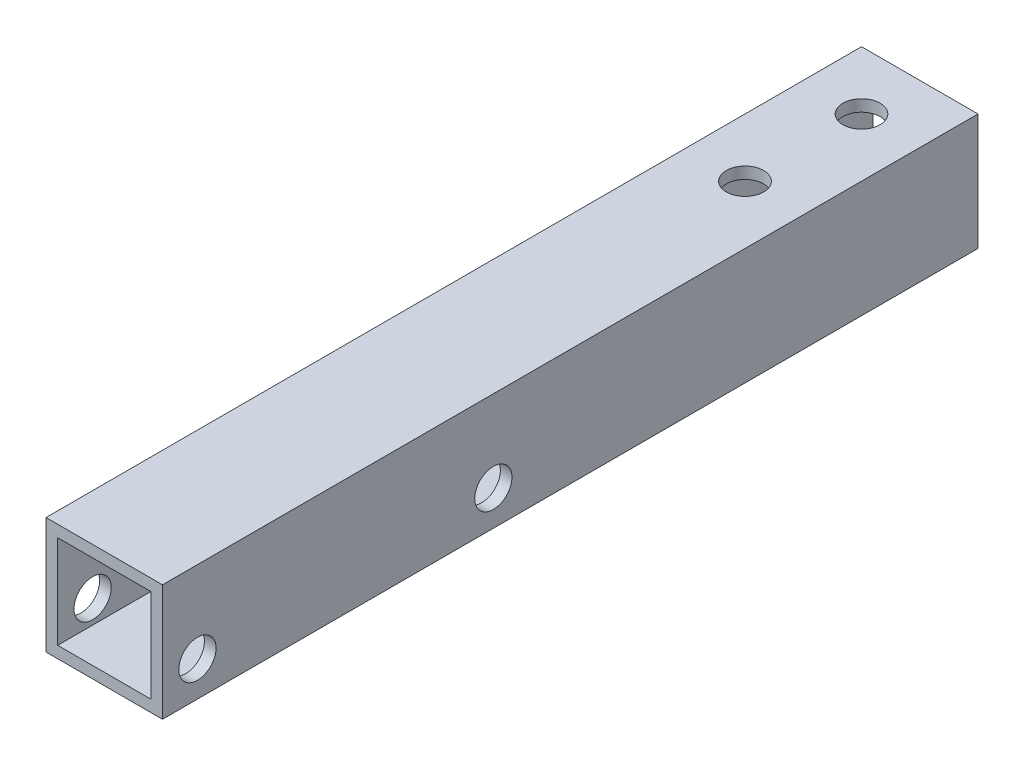
from build123d import *

# Parameters (mm, degrees)
SKETCH_1_W               = 10
SKETCH_1_H               = 10
SKETCH_1_W_2             = 8
SKETCH_1_H_2             = 8
EXTRUDE_1_DEPTH          = 70
CUT_EXTRUDE_2_DEPTH      = 71.887234394
CUT_EXTRUDE_2_DEPTH_BACK = 71.887234394
SKETCH_3_R               = 1.6
SKETCH_4_R               = 1.6
CUT_EXTRUDE_3_DEPTH      = 71.887234394


with BuildPart() as part:
    # ｽｹｯﾁ1 → 押し出し-薄板1 (new body)
    with BuildSketch(Plane.XY):
        Rectangle(SKETCH_1_W, SKETCH_1_H)
        Rectangle(SKETCH_1_W_2, SKETCH_1_H_2, mode=Mode.SUBTRACT)
    extrude(amount=EXTRUDE_1_DEPTH)

    # ｽｹｯﾁ3 → ｶｯﾄ - 押し出し2 (cut, two sides: drawn at the far end of the back side and taken through both)
    with BuildSketch(Plane(origin=(0, 5, 0), x_dir=(1, 0, 0), z_dir=(0, 1, 0)).offset(-CUT_EXTRUDE_2_DEPTH_BACK)):
        with Locations(Location((0, -5, 0), (0, 0, 180))):
            Circle(SKETCH_3_R)
        with Locations(Location((0, -15, 0), (0, 0, 180))):
            Circle(SKETCH_3_R)
    extrude(amount=CUT_EXTRUDE_2_DEPTH + CUT_EXTRUDE_2_DEPTH_BACK, mode=Mode.SUBTRACT)

    # ｽｹｯﾁ4 → ｶｯﾄ - 押し出し3 (cut, through all)
    with BuildSketch(Plane.ZY.offset(5)):
        with Locations(Location((67, -2, 0), (0, 0, 270))):
            Circle(SKETCH_4_R)
        with Locations(Location((41.6, -2, 0), (0, 0, 270))):
            Circle(SKETCH_4_R)
    extrude(amount=-CUT_EXTRUDE_3_DEPTH, mode=Mode.SUBTRACT)


solid = part.part
